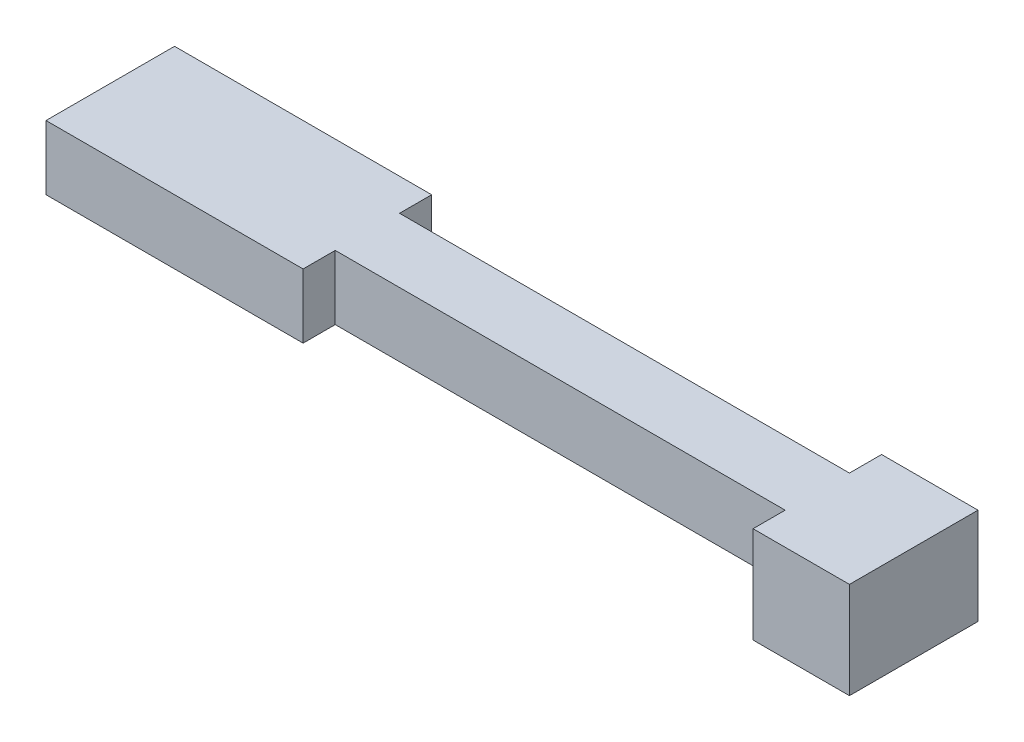
from build123d import *

# Parameters (mm, degrees)
SKETCH1_W           = 70
SKETCH1_H           = 10
SKETCH1_W_2         = 40
SKETCH1_H_2         = 20
BOSS_EXTRUDE1_DEPTH = 10
BOSS_EXTRUDE2_START = 10
BOSS_EXTRUDE2_DEPTH = 15


with BuildPart() as part:
    # Sketch1 → Boss-Extrude1 (new body)
    with BuildSketch(Plane(origin=(0, 0, 0), x_dir=(1, 0, 0), z_dir=(0, 1, 0))):
        with Locations((55, 0)):
            Rectangle(SKETCH1_W, SKETCH1_H)
        Rectangle(SKETCH1_W_2, SKETCH1_H_2)
    extrude(amount=BOSS_EXTRUDE1_DEPTH)

    # Sketch1<3> → Boss-Extrude2 (add)
    with BuildSketch(Plane(origin=(0, 0, 0), x_dir=(1, 0, 0), z_dir=(0, 1, 0)).offset(BOSS_EXTRUDE2_START)):
        Polygon((90, 5), (90, -5), (90, -10), (105, -10), (105, 10), (90, 10), align=None)
    extrude(amount=-BOSS_EXTRUDE2_DEPTH)


solid = part.part
